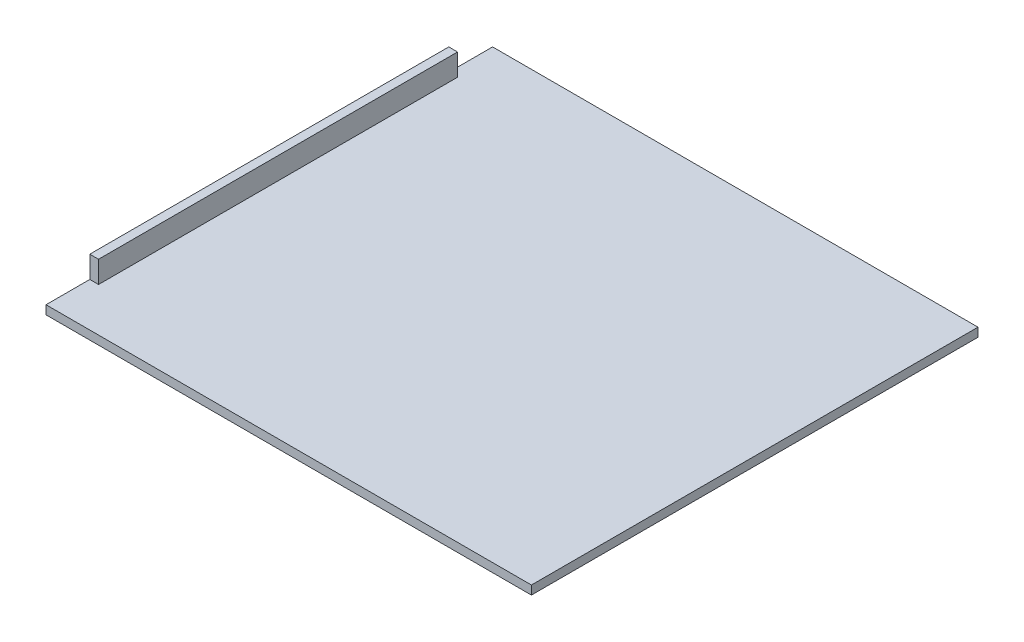
from build123d import *

# Parameters (mm, degrees)
SKETCH_1_W      = 110.87
SKETCH_1_H      = 102
EXTRUDE_1_DEPTH = 2
SKETCH_2_W      = 2
SKETCH_2_H      = 82
EXTRUDE_2_DEPTH = 5


with BuildPart() as part:
    # 스케치1 → 보스-돌출1 (new body)
    with BuildSketch(Plane(origin=(0, 0, 0), x_dir=(1, 0, 0), z_dir=(0, 1, 0))):
        Rectangle(SKETCH_1_W, SKETCH_1_H)
    extrude(amount=EXTRUDE_1_DEPTH)

    # 스케치2 → 보스-돌출2 (add)
    with BuildSketch(Plane(origin=(0, 2, 0), x_dir=(1, 0, 0), z_dir=(0, 1, 0))):
        with Locations((-54.435, 0)):
            Rectangle(SKETCH_2_W, SKETCH_2_H)
    extrude(amount=EXTRUDE_2_DEPTH)


solid = part.part
